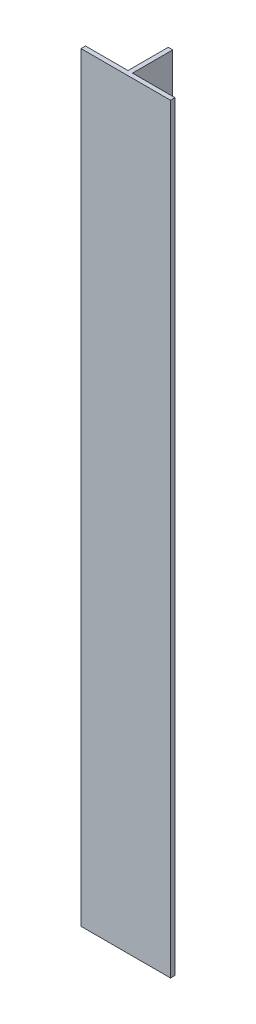
from build123d import *

# Parameters (mm, degrees)
BOSS_EXTRUDE1_DEPTH = 340


with BuildPart() as part:
    # Sketch1 → Boss-Extrude1 (new body)
    with BuildSketch(Plane(origin=(0, 0, 0), x_dir=(1, 0, 0), z_dir=(0, 1, 0))):
        Polygon((0, 5.361086759), (0, 23.361086759), (2, 23.361086759), (2, 5.361086759), (21, 5.361086759), (21, 3.361086759), (-19, 3.361086759), (-19, 5.361086759), align=None)
    extrude(amount=BOSS_EXTRUDE1_DEPTH)


solid = part.part
